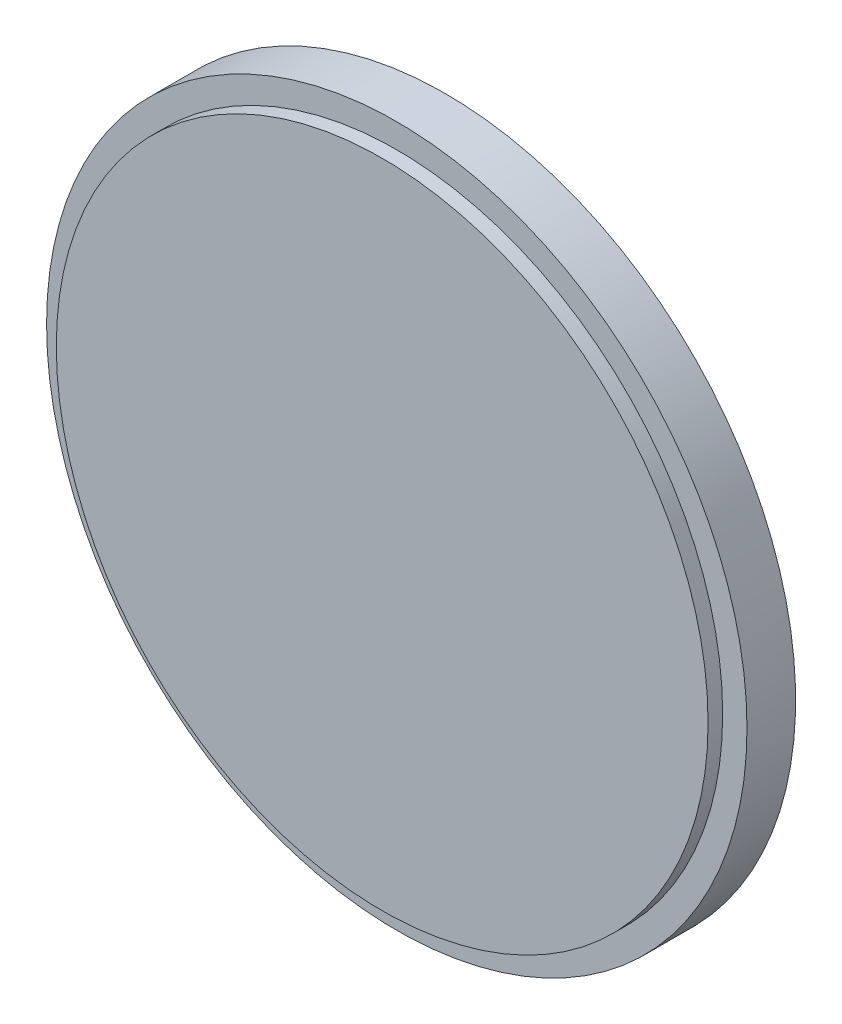
from build123d import *

# Parameters (mm, degrees)
ESBO_O1_R                     = 35
ESBO_O1_R_2                   = 32.5
RESSALTO_EXTRUS_O1_DEPTH      = 8
RESSALTO_EXTRUS_O2_START      = -3
ESBO_O2_R                     = 32.5
RESSALTO_EXTRUS_O2_DEPTH      = 3
ESBO_O3_R                     = 2.5
CORTE_EXTRUS_O1_DEPTH         = 3
RESSALTO_EXTRUS_O3_DEPTH      = 5
RESSALTO_EXTRUS_O3_DEPTH_BACK = 3
ESBO_O4_R                     = 37
ESBO_O4_R_2                   = 35
ESBO_O5_W                     = 1.8
ESBO_O5_H                     = 3
ESBO_O6_R                     = 12.55
RESSALTO_EXTRUS_O4_DEPTH      = 5
CORTE_EXTRUS_O2_DEPTH         = 53.933921071
CORTE_EXTRUS_O2_DEPTH_BACK    = 53.933921071
ESBO_O7_R                     = 7.55
RESSALTO_EXTRUS_O5_START      = -8
ESBO_O8_R                     = 37
ESBO_O8_R_2                   = 32.5
RESSALTO_EXTRUS_O5_DEPTH      = 8
ESBO_O9_R                     = 37
ESBO_O9_R_2                   = 33.5
CORTE_EXTRUS_O8_DEPTH         = 1.5
CORTE_EXTRUS_O9_START         = -1.5
ESBO_O12_R                    = 37
ESBO_O12_R_2                  = 33.5
CORTE_EXTRUS_O9_DEPTH         = 1.5
CORTE_EXTRUS_O10_START        = -10
ESBO_O13_R                    = 37
ESBO_O13_R_2                  = 36
CORTE_EXTRUS_O10_DEPTH        = 10
ESBO_O14_R                    = 37
ESBO_O14_R_2                  = 36
RESSALTO_EXTRUS_O6_DEPTH      = 5
ESBO_O15_R                    = 12.55
CORTE_EXTRUS_O11_DEPTH        = 53.933921071
ESBO_O16_R                    = 12.55
RESSALTO_EXTRUS_O7_DEPTH      = 3
ESBO_O17_R                    = 10
RESSALTO_EXTRUS_O8_DEPTH      = 16
ESBO_O18_R                    = 3.3
CORTE_EXTRUS_O12_DEPTH        = 16
ESBO_O23_R                    = 37
ESBO_O23_R_2                  = 36
CORTE_EXTRUS_O15_DEPTH        = 54.798234172
ESBO_O24_R                    = 3.3
RESSALTO_EXTRUS_O9_DEPTH      = 11
CORTE_EXTRUS_O14_DEPTH        = 56.88103435
CORTE_EXTRUS_O14_DEPTH_BACK   = 56.88103435
ESBO_O21_R                    = 2.2


with BuildPart() as part:
    # Esboço1 → Ressalto-extrusão1 (new body)
    with BuildSketch(Plane.XY):
        Circle(ESBO_O1_R)
        Circle(ESBO_O1_R_2, mode=Mode.SUBTRACT)
    extrude(amount=RESSALTO_EXTRUS_O1_DEPTH)

    # Esboço2 → Ressalto-extrusão2 (add)
    with BuildSketch(Plane.XY.offset(8).offset(RESSALTO_EXTRUS_O2_START)):
        Circle(ESBO_O2_R)
    extrude(amount=RESSALTO_EXTRUS_O2_DEPTH)

    # Esboço3 → Corte-extrusão1 (cut)
    with BuildSketch(Plane.XY.offset(8)):
        Circle(ESBO_O3_R)
    extrude(amount=-CORTE_EXTRUS_O1_DEPTH, mode=Mode.SUBTRACT)

    # Esboço4 → Ressalto-extrusão3 (add, two sides: drawn at the far end of the back side and taken through both)
    with BuildSketch(Plane(origin=(0, 0, 5), x_dir=(-1, 0, 0), z_dir=(0, 0, -1)).offset(-RESSALTO_EXTRUS_O3_DEPTH_BACK)):
        Circle(ESBO_O4_R)
        Circle(ESBO_O4_R_2, mode=Mode.SUBTRACT)
    extrude(amount=RESSALTO_EXTRUS_O3_DEPTH + RESSALTO_EXTRUS_O3_DEPTH_BACK)

    # Esboço5 → Corte-Revolução1 (revolve, cut)
    with BuildSketch(Plane(origin=(0, 0, 0), x_dir=(1, 0, 0), z_dir=(0, 1, 0))):
        with Locations((-36.1, -2.5)):
            Rectangle(ESBO_O5_W, ESBO_O5_H)
        with Locations((-36.1, -5.5)):
            Rectangle(ESBO_O5_W, ESBO_O5_H)
    revolve(axis=Axis((0, 0, 8), (0, 0, -1)), mode=Mode.SUBTRACT)

    # Esboço6 → Ressalto-extrusão4 (add)
    with BuildSketch(Plane(origin=(0, 0, 5), x_dir=(-1, 0, 0), z_dir=(0, 0, -1))):
        with Locations(Location((0, 0, 0), (0, 0, 180))):
            Circle(ESBO_O6_R)
    extrude(amount=RESSALTO_EXTRUS_O4_DEPTH)

    # Esboço7 → Corte-extrusão2 (cut, two sides: drawn at the far end of the back side and taken through both)
    with BuildSketch(Plane(origin=(0, 0, 0), x_dir=(-1, 0, 0), z_dir=(0, 0, -1)).offset(-CORTE_EXTRUS_O2_DEPTH_BACK)):
        Circle(ESBO_O7_R)
    extrude(amount=CORTE_EXTRUS_O2_DEPTH + CORTE_EXTRUS_O2_DEPTH_BACK, mode=Mode.SUBTRACT)

    # Esboço8 → Ressalto-extrusão5 (add)
    with BuildSketch(Plane.XY.offset(8).offset(RESSALTO_EXTRUS_O5_START)):
        with Locations(Location((0, 0, 0), (0, 0, 180))):
            Circle(ESBO_O8_R)
        Circle(ESBO_O8_R_2, mode=Mode.SUBTRACT)
    extrude(amount=RESSALTO_EXTRUS_O5_DEPTH)

    # Esboço9 → Corte-extrusão8 (cut)
    with BuildSketch(Plane.XY.offset(8)):
        with Locations(Location((0, 0, 0), (0, 0, 180))):
            Circle(ESBO_O9_R)
        Circle(ESBO_O9_R_2, mode=Mode.SUBTRACT)
    extrude(amount=-CORTE_EXTRUS_O8_DEPTH, mode=Mode.SUBTRACT)

    # Esboço12 → Corte-extrusão9 (cut)
    with BuildSketch(Plane(origin=(0, 0, 0), x_dir=(-1, 0, 0), z_dir=(0, 0, -1)).offset(CORTE_EXTRUS_O9_START)):
        Circle(ESBO_O12_R)
        with Locations(Location((0, 0, 0), (0, 0, 180))):
            Circle(ESBO_O12_R_2, mode=Mode.SUBTRACT)
    extrude(amount=CORTE_EXTRUS_O9_DEPTH, mode=Mode.SUBTRACT)

    # Esboço13 → Corte-extrusão10 (cut)
    with BuildSketch(Plane(origin=(0, 0, 1.5), x_dir=(-1, 0, 0), z_dir=(0, 0, -1)).offset(CORTE_EXTRUS_O10_START)):
        Circle(ESBO_O13_R)
        Circle(ESBO_O13_R_2, mode=Mode.SUBTRACT)
    extrude(amount=CORTE_EXTRUS_O10_DEPTH, mode=Mode.SUBTRACT)

    # Esboço14 → Ressalto-extrusão6 (add)
    with BuildSketch(Plane.XY.offset(6.5)):
        Circle(ESBO_O14_R)
        Circle(ESBO_O14_R_2, mode=Mode.SUBTRACT)
    extrude(amount=-RESSALTO_EXTRUS_O6_DEPTH)

    # Esboço15 → Corte-extrusão11 (cut, through all)
    with BuildSketch(Plane(origin=(0, 0, 0), x_dir=(-1, 0, 0), z_dir=(0, 0, -1))):
        Circle(ESBO_O15_R)
    extrude(amount=-CORTE_EXTRUS_O11_DEPTH, mode=Mode.SUBTRACT)

    # Esboço16 → Ressalto-extrusão7 (add, through all)
    with BuildSketch(Plane(origin=(0, 0, 5), x_dir=(-1, 0, 0), z_dir=(0, 0, -1))):
        Circle(ESBO_O16_R)
    extrude(amount=-RESSALTO_EXTRUS_O7_DEPTH)

    # Esboço17 → Ressalto-extrusão8 (add)
    with BuildSketch(Plane(origin=(0, 0, 5), x_dir=(-1, 0, 0), z_dir=(0, 0, -1))):
        with Locations(Location((0, 0, 0), (0, 0, 180))):
            Circle(ESBO_O17_R)
    extrude(amount=RESSALTO_EXTRUS_O8_DEPTH)

    # Esboço18 → Corte-extrusão12 (cut)
    with BuildSketch(Plane(origin=(0, 0, -11), x_dir=(-1, 0, 0), z_dir=(0, 0, -1))):
        Circle(ESBO_O18_R)
    extrude(amount=-CORTE_EXTRUS_O12_DEPTH, mode=Mode.SUBTRACT)

    # Esboço23 → Corte-extrusão15 (cut, through all)
    with BuildSketch(Plane(origin=(0, 0, 1.5), x_dir=(-1, 0, 0), z_dir=(0, 0, -1))):
        Circle(ESBO_O23_R)
        Circle(ESBO_O23_R_2, mode=Mode.SUBTRACT)
    extrude(amount=-CORTE_EXTRUS_O15_DEPTH, mode=Mode.SUBTRACT)

    # Esboço24 → Ressalto-extrusão9 (add)
    with BuildSketch(Plane(origin=(0, 0, -11), x_dir=(-1, 0, 0), z_dir=(0, 0, -1))):
        Circle(ESBO_O24_R)
        with BuildLine():
            Line((-1.229837388, 1.1), (1.229837388, 1.1))
            ThreePointArc((1.229837388, 1.1), (0, -1.65), (-1.229837388, 1.1))
        make_face(mode=Mode.SUBTRACT)
    extrude(amount=-RESSALTO_EXTRUS_O9_DEPTH)

    # Esboço21 → Corte-extrusão14 (cut, two sides: drawn at the far end of the back side and taken through both)
    with BuildSketch(Plane(origin=(0, 5.3, 0), x_dir=(1, 0, 0), z_dir=(0, 1, 0)).offset(-CORTE_EXTRUS_O14_DEPTH_BACK)):
        with Locations(Location((0, 6.85, 0), (0, 0, 180))):
            Circle(ESBO_O21_R)
    extrude(amount=CORTE_EXTRUS_O14_DEPTH + CORTE_EXTRUS_O14_DEPTH_BACK, mode=Mode.SUBTRACT)


solid = part.part
